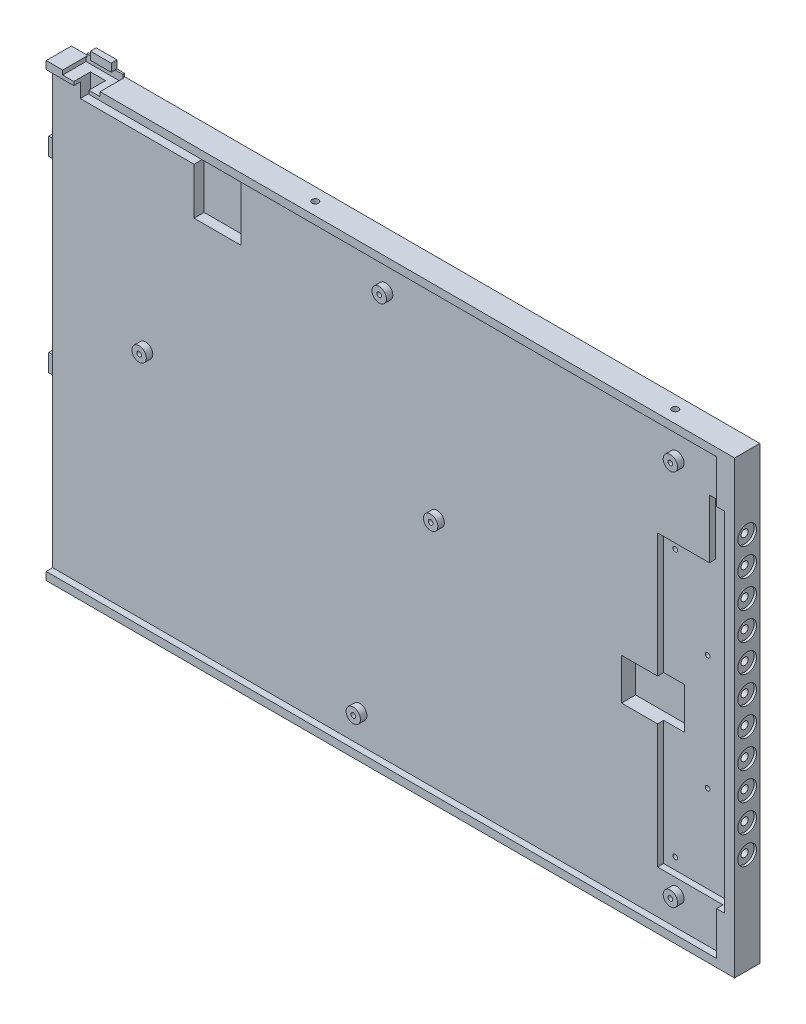
from build123d import *

# Parameters (mm, degrees)
SKETCH_1_W                      = 348.235
SKETCH_1_H                      = 124.714
EXTRUDE_1_DEPTH                 = 7
SKETCH_2_W                      = 344.235
SKETCH_2_H                      = 120.714
CUT_EXTRUDE_1_DEPTH             = 1.8
SKETCH_3_R                      = 2
SKETCH_3_R_2                    = 0.65
EXTRUDE_2_DEPTH                 = 1.8
CUT_EXTRUDE_2_DEPTH             = 370.930043415
CUT_EXTRUDE_2_DEPTH_BACK        = 1.7
SKETCH_4_W                      = 9.7
SKETCH_4_H                      = 80.4
SKETCH_6_W                      = 15.8
SKETCH_6_H                      = 9
CUT_EXTRUDE_3_DEPTH             = 3.9
EXTRUDE_3_DEPTH                 = 11.7
SKETCH_8_R                      = 0.7
CUT_EXTRUDE_4_DEPTH             = 3
SKETCH_9_W                      = 1
SKETCH_9_H                      = 80.4
EXTRUDE_4_DEPTH                 = 1.7
CUT_EXTRUDE_5_DEPTH             = 370.930043415
CUT_EXTRUDE_5_DEPTH_BACK        = 1.7
SKETCH_10_W                     = 20.2
SKETCH_10_H                     = 80.4
CUT_EXTRUDE_6_DEPTH             = 370.910052609
CUT_EXTRUDE_6_DEPTH_BACK        = 2.2
SKETCH_11_W                     = 15.8
SKETCH_11_H                     = 11.5
SKETCH_12_R                     = 0.65
CUT_EXTRUDE_7_DEPTH             = 3
SKETCH_13_W                     = 3
SKETCH_13_H                     = 124.714
EXTRUDE_5_DEPTH                 = 7
CUT_EXTRUDE_8_REACH             = 374.755
SKETCH_14_W                     = 6
SKETCH_14_H                     = 96.714
CUT_EXTRUDE_8_DIRECTION_2_DEPTH = 3
SKETCH_15_R                     = 2.6
CUT_EXTRUDE_9_DEPTH             = 0.7
SKETCH_15_3_R                   = 1
CUT_EXTRUDE_10_DEPTH            = 2.8
SKETCH_16_W                     = 362.935
SKETCH_16_H                     = 7
EXTRUDE_6_DEPTH                 = 0.2
SKETCH_17_W                     = 362.935
SKETCH_17_H                     = 7
EXTRUDE_7_DEPTH                 = 0.2
SKETCH_18_W                     = 10.4
SKETCH_18_H                     = 8.2
CUT_EXTRUDE_11_DEPTH            = 1.2
SKETCH_19_W                     = 4.2
SKETCH_19_H                     = 4.6
CUT_EXTRUDE_12_DEPTH            = 2.2
SKETCH_20_W                     = 10
SKETCH_20_H                     = 0.5
EXTRUDE_8_DEPTH                 = 0.8
SKETCH_21_W                     = 5.8
SKETCH_21_H                     = 1.6
EXTRUDE_9_DEPTH                 = 2.2
SKETCH_22_W                     = 13
SKETCH_22_H                     = 13
CUT_EXTRUDE_13_DEPTH            = 2.8
SKETCH_23_R                     = 5.6
SKETCH_23_R_2                   = 4.1
CUT_EXTRUDE_14_DEPTH            = 1
SKETCH_24_R                     = 0.9
CUT_EXTRUDE_15_DEPTH            = 3
CUT_EXTRUDE_START               = -122.114
SKETCH_24_2_R                   = 0.9
CUT_EXTRUDE_16_DEPTH            = 3
CUT_EXTRUDE_8793_DEPTH          = 373.822441145
CUT_EXTRUDE_8793_DEPTH_BACK     = 373.822441145
SKETCH_25_W                     = 175.474128517
SKETCH_25_H                     = 185.344548245
SKETCH_26_W                     = 2.6
SKETCH_26_H                     = 5.1
CUT_EXTRUDE_18_DEPTH            = 3
SKETCH_26_3_W                   = 2.4
SKETCH_26_3_H                   = 4.9
EXTRUDE_10_DEPTH                = 2.5


with BuildPart() as part:
    # 草图1 → 凸台-拉伸1 (new body)
    with BuildSketch(Plane.XY):
        with Locations((174.1175, -62.357)):
            Rectangle(SKETCH_1_W, SKETCH_1_H)
    extrude(amount=EXTRUDE_1_DEPTH)

    # 草图2 → 切除-拉伸1 (cut)
    with BuildSketch(Plane.XY.offset(7)):
        with Locations((174.1175, -62.357)):
            Rectangle(SKETCH_2_W, SKETCH_2_H)
    extrude(amount=-CUT_EXTRUDE_1_DEPTH, mode=Mode.SUBTRACT)

    # 草图3 → 凸台-拉伸2 (add)
    # profile 1 of 11: a face of its own
    with BuildSketch(Plane.XY.offset(5.2)):
        with Locations((4.8, -9.9)):
            Circle(SKETCH_3_R)
        with Locations((4.8, -9.9)):
            Circle(SKETCH_3_R_2, mode=Mode.SUBTRACT)
    # profile 2 of 11: a face of its own
    with BuildSketch(Plane.XY.offset(5.2)):
        with Locations((7.2, -114.7)):
            Circle(SKETCH_3_R)
        with Locations((7.2, -114.7)):
            Circle(SKETCH_3_R_2, mode=Mode.SUBTRACT)
    # profile 3 of 11: a face of its own
    with BuildSketch(Plane.XY.offset(5.2)):
        with Locations((76.2, -76.6)):
            Circle(SKETCH_3_R)
        with Locations((76.2, -76.6)):
            Circle(SKETCH_3_R_2, mode=Mode.SUBTRACT)
    # profile 4 of 11: a face of its own
    with BuildSketch(Plane.XY.offset(5.2)):
        with Locations((128.6, -9.9)):
            Circle(SKETCH_3_R)
        with Locations((128.6, -9.9)):
            Circle(SKETCH_3_R_2, mode=Mode.SUBTRACT)
    # profile 5 of 11: a face of its own
    with BuildSketch(Plane.XY.offset(5.2)):
        with Locations((126.3, -114.7)):
            Circle(SKETCH_3_R)
        with Locations((126.3, -114.7)):
            Circle(SKETCH_3_R_2, mode=Mode.SUBTRACT)
    # profile 6 of 11: a face of its own
    with BuildSketch(Plane.XY.offset(5.2)):
        with Locations((185.8, -57.5)):
            Circle(SKETCH_3_R)
        with Locations((185.8, -57.5)):
            Circle(SKETCH_3_R_2, mode=Mode.SUBTRACT)
    # profile 7 of 11: a face of its own
    with BuildSketch(Plane.XY.offset(5.2)):
        with Locations((252.5, -9.9)):
            Circle(SKETCH_3_R)
        with Locations((252.5, -9.9)):
            Circle(SKETCH_3_R_2, mode=Mode.SUBTRACT)
    # profile 8 of 11: a face of its own
    with BuildSketch(Plane.XY.offset(5.2)):
        with Locations((245.3, -114.7)):
            Circle(SKETCH_3_R)
        with Locations((245.3, -114.7)):
            Circle(SKETCH_3_R_2, mode=Mode.SUBTRACT)
    # profile 9 of 11: a face of its own
    with BuildSketch(Plane.XY.offset(5.2)):
        with Locations((333.4, -9.9)):
            Circle(SKETCH_3_R)
        with Locations((333.4, -9.9)):
            Circle(SKETCH_3_R_2, mode=Mode.SUBTRACT)
    # profile 10 of 11: a face of its own
    with BuildSketch(Plane.XY.offset(5.2)):
        with Locations((333.4, -114.7)):
            Circle(SKETCH_3_R)
        with Locations((333.4, -114.7)):
            Circle(SKETCH_3_R_2, mode=Mode.SUBTRACT)
    # profile 11 of 11: a face of its own
    with BuildSketch(Plane.XY.offset(5.2)):
        with Locations((266.8, -57.5)):
            Circle(SKETCH_3_R)
        with Locations((266.8, -57.5)):
            Circle(SKETCH_3_R_2, mode=Mode.SUBTRACT)
    extrude(amount=EXTRUDE_2_DEPTH)

    # 草图4 → 切除-拉伸2 (cut, two sides: drawn at the far end of the back side and taken through both)
    with BuildSketch(Plane.XY.offset(5.2).offset(-CUT_EXTRUDE_2_DEPTH_BACK)):
        with Locations((4.85, -67.714)):
            Rectangle(SKETCH_4_W, SKETCH_4_H)
    extrude(amount=CUT_EXTRUDE_2_DEPTH + CUT_EXTRUDE_2_DEPTH_BACK, mode=Mode.SUBTRACT)

    # 草图6 → 切除-拉伸3 (cut)
    with BuildSketch(Plane.XY.offset(5.2)):
        with Locations((11.8, -67.714)):
            Rectangle(SKETCH_6_W, SKETCH_6_H)
    extrude(amount=-CUT_EXTRUDE_3_DEPTH, mode=Mode.SUBTRACT)

    # 草图7 → 凸台-拉伸3 (add)
    with BuildSketch(Plane.ZY):
        Polygon((7, 0), (0, 0), (0, -124.714), (7, -124.714), (7, -107.914), (3.5, -107.914), (3.5, -27.514), (7, -27.514), align=None)
    extrude(amount=EXTRUDE_3_DEPTH)

    # 草图8 → 切除-拉伸4 (cut)
    with BuildSketch(Plane.XY.offset(3.5)):
        with Locations((-5.5, -82.714)):
            Circle(SKETCH_8_R)
        with Locations((4.5, -102.714)):
            Circle(SKETCH_8_R)
        with Locations((-5.5, -52.714)):
            Circle(SKETCH_8_R)
        with Locations((4.5, -32.714)):
            Circle(SKETCH_8_R)
    extrude(amount=-CUT_EXTRUDE_4_DEPTH, mode=Mode.SUBTRACT)

    # 草图9 → 凸台-拉伸4 (add)
    with BuildSketch(Plane.XY.offset(3.5)):
        with Locations((-11.2, -67.714)):
            Rectangle(SKETCH_9_W, SKETCH_9_H)
    extrude(amount=EXTRUDE_4_DEPTH)

    # 草图10 → 切除-拉伸5 (cut, two sides: drawn at the far end of the back side and taken through both)
    with BuildSketch(Plane.XY.offset(5.2).offset(-CUT_EXTRUDE_5_DEPTH_BACK)):
        with Locations((338.135, -70.514)):
            Rectangle(SKETCH_10_W, SKETCH_10_H)
    extrude(amount=CUT_EXTRUDE_5_DEPTH + CUT_EXTRUDE_5_DEPTH_BACK, mode=Mode.SUBTRACT)

    # 草图11 → 切除-拉伸6 (cut, two sides: drawn at the far end of the back side and taken through both)
    with BuildSketch(Plane.XY.offset(3.5).offset(-CUT_EXTRUDE_6_DEPTH_BACK)):
        with Locations((325.935, -70.514)):
            Rectangle(SKETCH_11_W, SKETCH_11_H)
    extrude(amount=CUT_EXTRUDE_6_DEPTH + CUT_EXTRUDE_6_DEPTH_BACK, mode=Mode.SUBTRACT)

    # 草图12 → 切除-拉伸7 (cut)
    with BuildSketch(Plane.XY.offset(3.5)):
        with Locations((331.235, -107.514)):
            Circle(SKETCH_12_R)
        with Locations((340.235, -86.514)):
            Circle(SKETCH_12_R)
        with Locations((340.235, -54.514)):
            Circle(SKETCH_12_R)
        with Locations((331.235, -33.514)):
            Circle(SKETCH_12_R)
    extrude(amount=-CUT_EXTRUDE_7_DEPTH, mode=Mode.SUBTRACT)

    # 草图13 → 凸台-拉伸5 (add)
    with BuildSketch(Plane(origin=(0, 0, 0), x_dir=(-1, 0, 0), z_dir=(0, 0, -1))):
        with Locations((-349.735, -62.357)):
            Rectangle(SKETCH_13_W, SKETCH_13_H)
    extrude(amount=-EXTRUDE_5_DEPTH)

    # 切除-拉伸8: up to this face of the body (flat: up to its plane)
    cut_extrude_8_end = Plane(part.part.faces().sort_by_distance((338.452628763, -70.514, 3.5))[0])
    # 草图14 → 切除-拉伸8 (cut, up to the picked face)
    with BuildSketch(Plane.XY.offset(5.2), mode=Mode.PRIVATE) as cut_extrude_8_sk1:
        with Locations((345.435, -62.357)):
            Rectangle(SKETCH_14_W, SKETCH_14_H)
    cut_extrude_8_tool1 = split(extrude(cut_extrude_8_sk1.sketch, amount=-CUT_EXTRUDE_8_REACH, mode=Mode.PRIVATE), bisect_by=cut_extrude_8_end, keep=Keep.BOTH, mode=Mode.PRIVATE)
    add(cut_extrude_8_tool1.solids().sort_by(Axis((345.435, -62.357, 5.2), (0, 0, -1)))[0], mode=Mode.SUBTRACT)

    # 草图14 → 切除-拉伸8 direction 2 (cut)
    with BuildSketch(Plane.XY.offset(5.2)):
        with Locations((345.435, -62.357)):
            Rectangle(SKETCH_14_W, SKETCH_14_H)
    extrude(amount=CUT_EXTRUDE_8_DIRECTION_2_DEPTH, mode=Mode.SUBTRACT)

    # 草图15 → 切除-拉伸9 (cut)
    with BuildSketch(Plane(origin=(351.235, 0, 0), x_dir=(0, 0, -1), z_dir=(1, 0, 0))):
        with Locations((-3.5, -20)):
            Circle(SKETCH_15_R)
        with Locations((-3.5, -27.701272727)):
            Circle(SKETCH_15_R)
        with Locations((-3.5, -35.402545455)):
            Circle(SKETCH_15_R)
        with Locations((-3.5, -43.103818182)):
            Circle(SKETCH_15_R)
        with Locations((-3.5, -50.805090909)):
            Circle(SKETCH_15_R)
        with Locations((-3.5, -58.506363636)):
            Circle(SKETCH_15_R)
        with Locations((-3.5, -66.207636364)):
            Circle(SKETCH_15_R)
        with Locations((-3.5, -73.908909091)):
            Circle(SKETCH_15_R)
        with Locations((-3.5, -81.610181818)):
            Circle(SKETCH_15_R)
        with Locations((-3.5, -89.311454545)):
            Circle(SKETCH_15_R)
        with Locations((-3.5, -97.012727273)):
            Circle(SKETCH_15_R)
    extrude(amount=-CUT_EXTRUDE_9_DEPTH, mode=Mode.SUBTRACT)

    # 草图15<3> → 切除-拉伸10 (cut)
    with BuildSketch(Plane(origin=(351.235, 0, 0), x_dir=(0, 0, -1), z_dir=(1, 0, 0))):
        with Locations((-3.5, -20)):
            Circle(SKETCH_15_3_R)
        with Locations((-3.5, -27.701272727)):
            Circle(SKETCH_15_3_R)
        with Locations((-3.5, -35.402545455)):
            Circle(SKETCH_15_3_R)
        with Locations((-3.5, -43.103818182)):
            Circle(SKETCH_15_3_R)
        with Locations((-3.5, -50.805090909)):
            Circle(SKETCH_15_3_R)
        with Locations((-3.5, -58.506363636)):
            Circle(SKETCH_15_3_R)
        with Locations((-3.5, -66.207636364)):
            Circle(SKETCH_15_3_R)
        with Locations((-3.5, -73.908909091)):
            Circle(SKETCH_15_3_R)
        with Locations((-3.5, -81.610181818)):
            Circle(SKETCH_15_3_R)
        with Locations((-3.5, -89.311454545)):
            Circle(SKETCH_15_3_R)
        with Locations((-3.5, -97.012727273)):
            Circle(SKETCH_15_3_R)
    extrude(amount=-CUT_EXTRUDE_10_DEPTH, mode=Mode.SUBTRACT)

    # 草图16 → 凸台-拉伸6 (add)
    with BuildSketch(Plane(origin=(0, 0, 0), x_dir=(1, 0, 0), z_dir=(0, 1, 0))):
        with Locations((169.7675, -3.5)):
            Rectangle(SKETCH_16_W, SKETCH_16_H)
    extrude(amount=EXTRUDE_6_DEPTH)

    # 草图17 → 凸台-拉伸7 (add)
    with BuildSketch(Plane.XZ.offset(124.714)):
        with Locations((169.7675, 3.5)):
            Rectangle(SKETCH_17_W, SKETCH_17_H)
    extrude(amount=EXTRUDE_7_DEPTH)

    # 草图18 → 切除-拉伸11 (cut)
    with BuildSketch(Plane(origin=(0, 0.2, 0), x_dir=(1, 0, 0), z_dir=(0, 1, 0))):
        with Locations((169.7675, -4.6)):
            Rectangle(SKETCH_18_W, SKETCH_18_H)
    extrude(amount=-CUT_EXTRUDE_11_DEPTH, mode=Mode.SUBTRACT)

    # 草图19 → 切除-拉伸12 (cut)
    with BuildSketch(Plane(origin=(0, 0.2, 0), x_dir=(1, 0, 0), z_dir=(0, 1, 0))):
        with Locations((169.7675, -4.7)):
            Rectangle(SKETCH_19_W, SKETCH_19_H)
    extrude(amount=-CUT_EXTRUDE_12_DEPTH, mode=Mode.SUBTRACT)

    # 草图20 → 凸台-拉伸8 (add)
    with BuildSketch(Plane(origin=(0, 0.2, 0), x_dir=(1, 0, 0), z_dir=(0, 1, 0))):
        with Locations((169.7675, -0.25)):
            Rectangle(SKETCH_20_W, SKETCH_20_H)
    extrude(amount=EXTRUDE_8_DEPTH)

    # 草图21 → 凸台-拉伸9 (add)
    with BuildSketch(Plane(origin=(0, 1, 0), x_dir=(1, 0, 0), z_dir=(0, 1, 0))):
        with Locations((169.7675, -0.8)):
            Rectangle(SKETCH_21_W, SKETCH_21_H)
    extrude(amount=EXTRUDE_9_DEPTH)

    # 草图22 → 切除-拉伸13 (cut)
    with BuildSketch(Plane.XY.offset(5.2)):
        Polygon((171.8675, -2), (167.6675, -2), (167.6675, -6), (199.2675, -6), (212.2675, -6), (212.2675, -2), align=None)
        with Locations((205.7675, -12.5)):
            Rectangle(SKETCH_22_W, SKETCH_22_H)
    extrude(amount=-CUT_EXTRUDE_13_DEPTH, mode=Mode.SUBTRACT)

    # 草图23 → 切除-拉伸14 (cut)
    with BuildSketch(Plane(origin=(0, 0, 0), x_dir=(-1, 0, 0), z_dir=(0, 0, -1))):
        with Locations((-331.235, -19.8)):
            Circle(SKETCH_23_R)
        with Locations((-231.235, -19.8)):
            Circle(SKETCH_23_R)
        with Locations((-108.3, -19.8)):
            Circle(SKETCH_23_R)
        with Locations((-8.3, -19.8)):
            Circle(SKETCH_23_R)
        with Locations((-331.235, -104.914)):
            Circle(SKETCH_23_R_2)
        with Locations((-231.235, -104.914)):
            Circle(SKETCH_23_R_2)
        with Locations((-108.3, -104.914)):
            Circle(SKETCH_23_R_2)
        with Locations((-8.3, -104.914)):
            Circle(SKETCH_23_R_2)
    extrude(amount=-CUT_EXTRUDE_14_DEPTH, mode=Mode.SUBTRACT)

    # 草图24 → 切除-拉伸15 (cut)
    with BuildSketch(Plane(origin=(0, 0.2, 0), x_dir=(1, 0, 0), z_dir=(0, 1, 0))):
        with Locations(Location((8.3, -3.5, 0), (0, 0, 270))):
            Circle(SKETCH_24_R)
        with Locations(Location((108.3, -3.5, 0), (0, 0, 270))):
            Circle(SKETCH_24_R)
        with Locations(Location((231.235, -3.5, 0), (0, 0, 270))):
            Circle(SKETCH_24_R)
        with Locations(Location((331.235, -3.5, 0), (0, 0, 270))):
            Circle(SKETCH_24_R)
    extrude(amount=-CUT_EXTRUDE_15_DEPTH, mode=Mode.SUBTRACT)

    # 草图24<2> → 切除-拉伸16 (cut)
    with BuildSketch(Plane(origin=(0, 0.2, 0), x_dir=(1, 0, 0), z_dir=(0, 1, 0)).offset(CUT_EXTRUDE_START)):
        with Locations(Location((8.3, -3.5, 0), (0, 0, 270))):
            Circle(SKETCH_24_2_R)
        with Locations(Location((108.3, -3.5, 0), (0, 0, 270))):
            Circle(SKETCH_24_2_R)
        with Locations(Location((231.235, -3.5, 0), (0, 0, 270))):
            Circle(SKETCH_24_2_R)
        with Locations(Location((331.235, -3.5, 0), (0, 0, 270))):
            Circle(SKETCH_24_2_R)
    extrude(amount=-CUT_EXTRUDE_16_DEPTH, mode=Mode.SUBTRACT)

    # 草图25 → Cut-Extrude 8793 (cut, two sides: drawn at the far end of the back side and taken through both)
    with BuildSketch(Plane.XY.offset(5.2).offset(-CUT_EXTRUDE_8793_DEPTH_BACK)):
        with Locations((72.262935742, -51.035724743)):
            Rectangle(SKETCH_25_W, SKETCH_25_H)
    extrude(amount=CUT_EXTRUDE_8793_DEPTH + CUT_EXTRUDE_8793_DEPTH_BACK, mode=Mode.SUBTRACT)

    # 草图26 → 切除-拉伸18 (cut)
    with BuildSketch(Plane.ZY.offset(-160)):
        with Locations((2.6, -101.3412)):
            Rectangle(SKETCH_26_W, SKETCH_26_H)
        with Locations((2.6, -49.2956)):
            Rectangle(SKETCH_26_W, SKETCH_26_H)
    extrude(amount=-CUT_EXTRUDE_18_DEPTH, mode=Mode.SUBTRACT)

    # 草图26<3> → 凸台-拉伸10 (add)
    with BuildSketch(Plane.ZY.offset(-160)):
        with Locations((2.6, -23.2728)):
            Rectangle(SKETCH_26_3_W, SKETCH_26_3_H)
        with Locations((2.6, -75.3184)):
            Rectangle(SKETCH_26_3_W, SKETCH_26_3_H)
    extrude(amount=EXTRUDE_10_DEPTH)


solid = part.part
